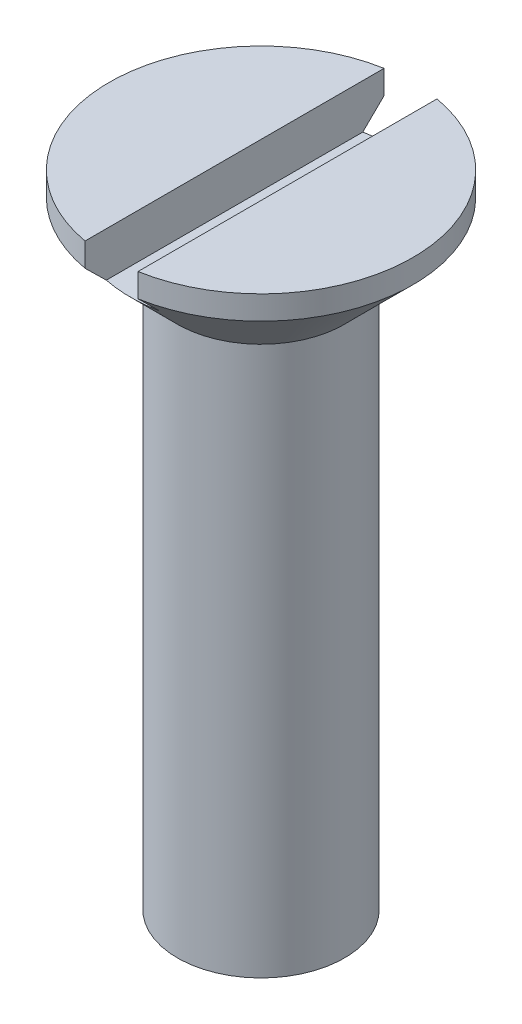
from build123d import *

# Parameters (mm, degrees)
CUT_EXTRUDE1_DEPTH      = 25.257060828
CUT_EXTRUDE1_DEPTH_BACK = 25.257060828
SKETCH2_W               = 1.9
SKETCH2_H               = 1.6


with BuildPart() as part:
    # Sketch1 → Revolve1 (revolve)
    with BuildSketch(Plane.XY):
        Polygon((0, 23), (-5.45, 23), (-5.45, 22.15), (-3, 19.7), (-3, 0), (0, -1.732050808), align=None)
    revolve(axis=Axis((0, 23, 0), (0, -1, 0)))

    # Sketch2 → Cut-Extrude1 (cut, two sides: drawn at the far end of the back side and taken through both)
    with BuildSketch(Plane.XY.offset(-CUT_EXTRUDE1_DEPTH_BACK)):
        with Locations((0, 22.2)):
            Rectangle(SKETCH2_W, SKETCH2_H)
    extrude(amount=CUT_EXTRUDE1_DEPTH + CUT_EXTRUDE1_DEPTH_BACK, mode=Mode.SUBTRACT)


solid = part.part
